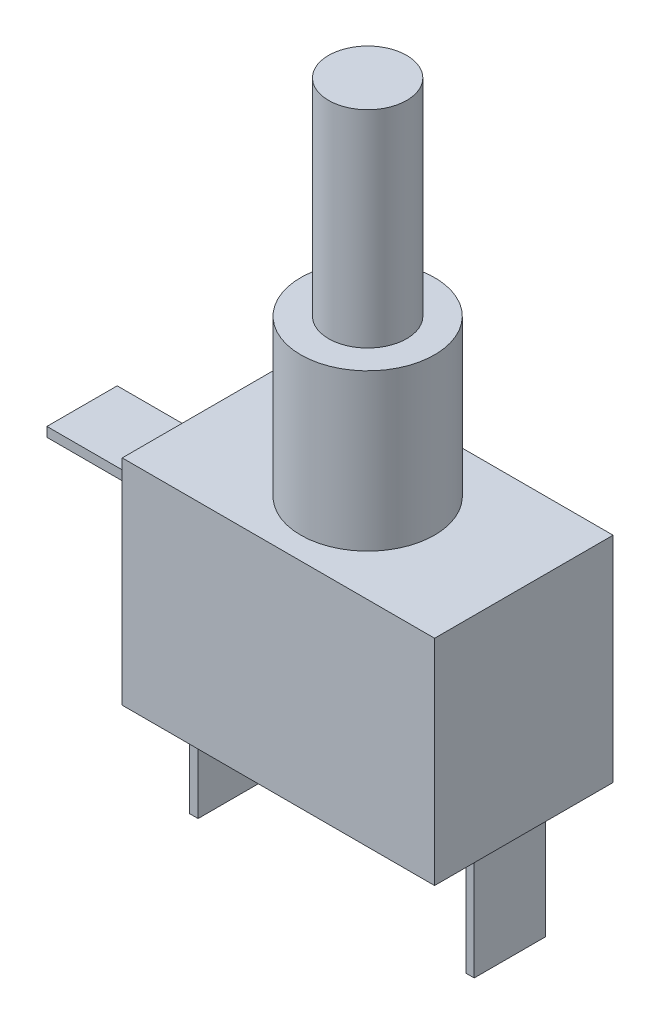
from build123d import *

# Parameters (mm, degrees)
SKETCH1_W           = 28
SKETCH1_H           = 16
BOSS_EXTRUDE1_DEPTH = 19.2
SKETCH2_W           = 0.75
SKETCH2_H           = 6.4
BOSS_EXTRUDE2_DEPTH = 10.2
SKETCH3_W           = 6.3
SKETCH3_H           = 0.85
BOSS_EXTRUDE3_DEPTH = 8.45
BOSS_EXTRUDE4_DEPTH = 14
SKETCH5_R           = 3.5
BOSS_EXTRUDE5_DEPTH = 18.5


with BuildPart() as part:
    # Sketch1 → Boss-Extrude1 (new body)
    with BuildSketch(Plane(origin=(0, 0, 0), x_dir=(1, 0, 0), z_dir=(0, 1, 0))):
        with Locations((-14, 8)):
            Rectangle(SKETCH1_W, SKETCH1_H)
    extrude(amount=BOSS_EXTRUDE1_DEPTH)

    # Sketch2 → Boss-Extrude2 (add)
    with BuildSketch(Plane.XZ):
        with Locations((-1.625, -8)):
            Rectangle(SKETCH2_W, SKETCH2_H)
        with Locations((-26.375, -8)):
            Rectangle(SKETCH2_W, SKETCH2_H)
    extrude(amount=BOSS_EXTRUDE2_DEPTH)

    # Sketch3 → Boss-Extrude3 (add)
    with BuildSketch(Plane.ZY.offset(28)):
        with Locations((-4.85, 16.145)):
            Rectangle(SKETCH3_W, SKETCH3_H)
    extrude(amount=BOSS_EXTRUDE3_DEPTH)

    # Sketch4 → Boss-Extrude4 (add)
    with BuildSketch(Plane(origin=(0, 19.2, 0), x_dir=(1, 0, 0), z_dir=(0, 1, 0))):
        with BuildLine():
            ThreePointArc((-8.790541147, 10.97683363), (-16.97683363, 13.209458853), (-19.209458853, 5.02316637))
            Line((-19.209458853, 5.02316637), (-8.790541147, 10.97683363))
        make_face()
        with BuildLine():
            Line((-8.790541147, 10.97683363), (-19.209458853, 5.02316637))
            ThreePointArc((-19.209458853, 5.02316637), (-12.459992389, 2.201002107), (-8, 8))
            ThreePointArc((-8, 8), (-8.201002107, 9.540007611), (-8.790541147, 10.97683363))
        make_face()
    extrude(amount=BOSS_EXTRUDE4_DEPTH)

    # Sketch5 → Boss-Extrude5 (add)
    with BuildSketch(Plane(origin=(0, 33.2, 0), x_dir=(1, 0, 0), z_dir=(0, 1, 0))):
        with Locations(Location((-14, 8, 0), (0, 0, 270))):
            Circle(SKETCH5_R)
    extrude(amount=BOSS_EXTRUDE5_DEPTH)


solid = part.part
